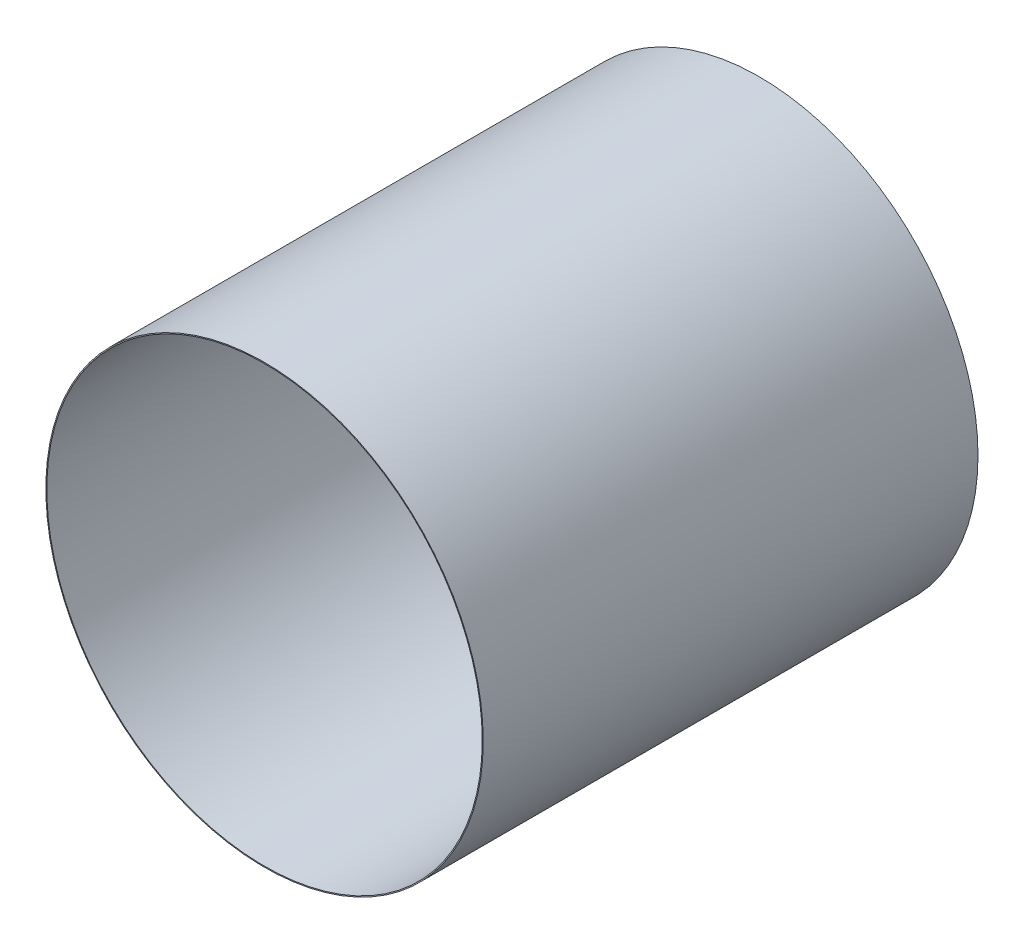
from build123d import *

# Parameters (mm, degrees)
SKETCH1_R           = 11.05
SKETCH1_R_2         = 11
BOSS_EXTRUDE1_DEPTH = 25


with BuildPart() as part:
    # Sketch1 → Boss-Extrude1 (new body)
    with BuildSketch(Plane.XY):
        Circle(SKETCH1_R)
        Circle(SKETCH1_R_2, mode=Mode.SUBTRACT)
    extrude(amount=BOSS_EXTRUDE1_DEPTH)


solid = part.part
